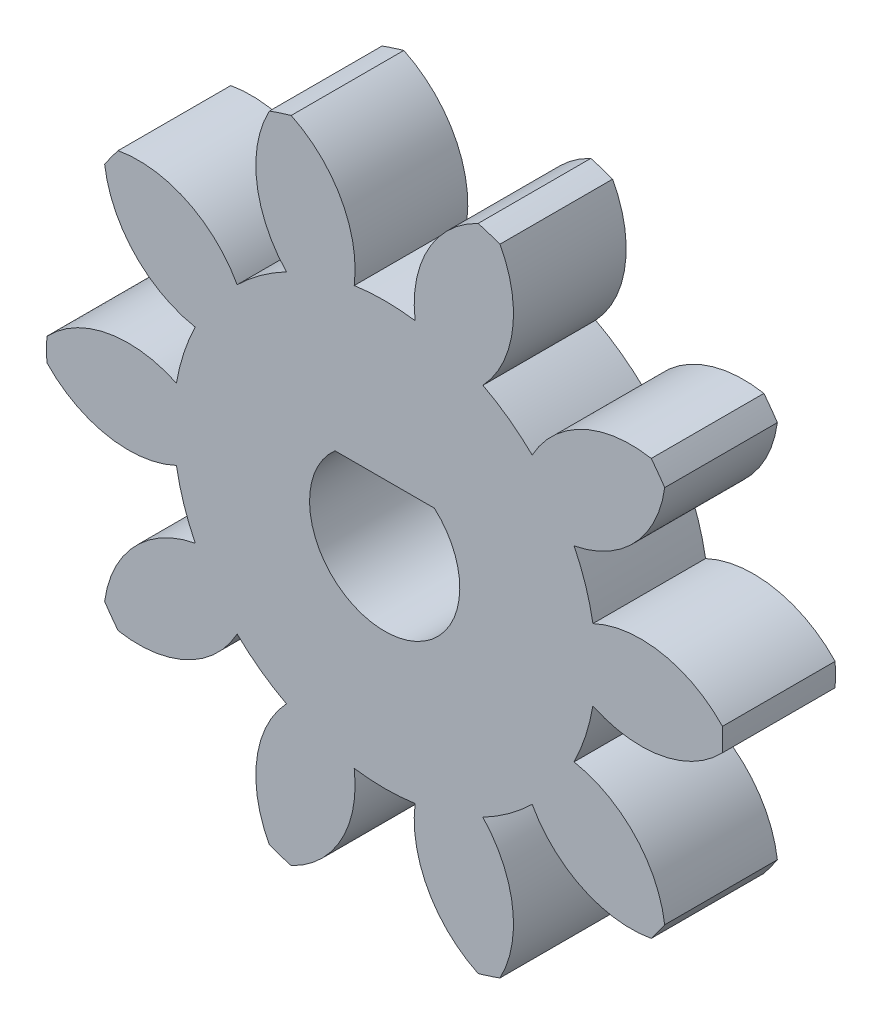
from build123d import *

# Parameters (mm, degrees)
SKETCH1_R           = 9
BOSS_EXTRUDE1_DEPTH = 3
CUT_EXTRUDE1_DEPTH  = 14.076696831
CIRPATTERN2_COUNT   = 10
CUT_EXTRUDE3_DEPTH  = 13.837585931


with BuildPart() as part:
    # Sketch1 → Boss-Extrude1 (new body)
    with BuildSketch(Plane.XY):
        Circle(SKETCH1_R)
    extrude(amount=BOSS_EXTRUDE1_DEPTH)

    # Sketch2 → Cut-Extrude1 (cut, through all)
    with BuildSketch(Plane.XY.offset(3)):
        with BuildLine():
            ThreePointArc((-0.810569881, 5.566291536), (0, 5.625), (0.810569881, 5.566291536))
            ThreePointArc((0.810569881, 5.566291536), (1.152028564, 7.378729724), (2.489254397, 8.648908171))
            ThreePointArc((2.489254397, 8.648908171), (0, 9), (-2.489254397, 8.648908171))
            ThreePointArc((-2.489254397, 8.648908171), (-1.152028564, 7.378729724), (-0.810569881, 5.566291536))
        make_face()
    cut_extrude1 = extrude(amount=-CUT_EXTRUDE1_DEPTH, mode=Mode.SUBTRACT)

    # CirPattern2: Cut-Extrude1 ×10 about axis
    cirpattern2_axis = Axis((0, 0, 0), (0, 0, 1))
    for i in range(1, CIRPATTERN2_COUNT):
        add(cut_extrude1.rotate(cirpattern2_axis, i * 360 / CIRPATTERN2_COUNT), mode=Mode.SUBTRACT)

    # Sketch5 → Cut-Extrude3 (cut, through all)
    with BuildSketch(Plane.XY.offset(3)):
        with BuildLine():
            Line((-1.322875656, 1.5), (1.322875656, 1.5))
            ThreePointArc((1.322875656, 1.5), (0, -2), (-1.322875656, 1.5))
        make_face()
    extrude(amount=-CUT_EXTRUDE3_DEPTH, mode=Mode.SUBTRACT)


solid = part.part
